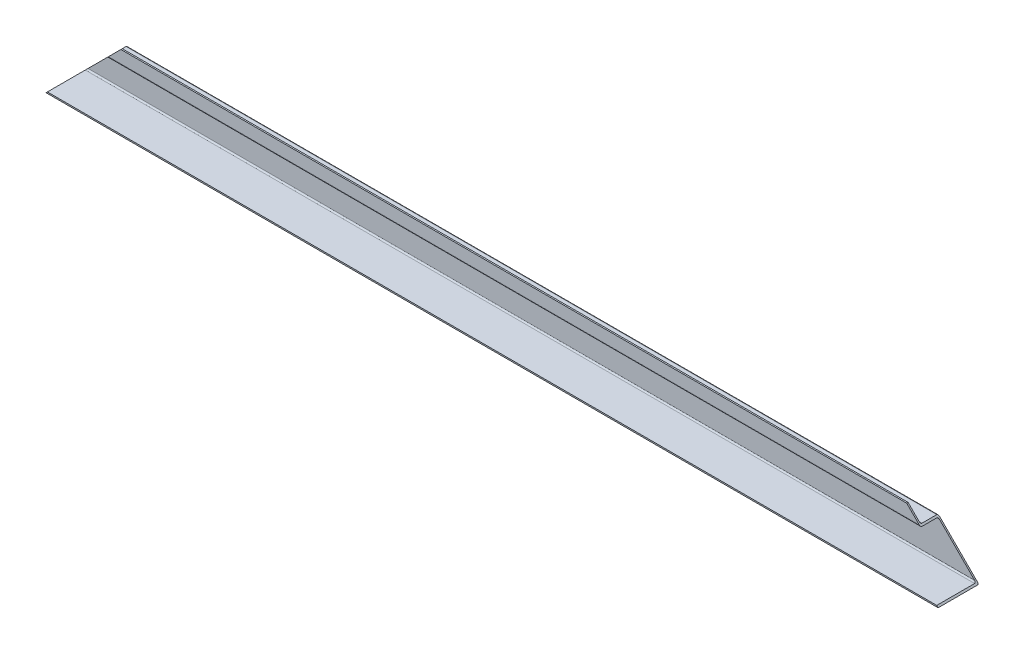
from build123d import *

# Parameters (mm, degrees)
BOSS_EXTRUDE1_DEPTH = 1930
FILLET1_R           = 3
CUT_EXTRUDE1_DEPTH  = 88
CUT_EXTRUDE2_DEPTH  = 88


with BuildPart() as part:
    # Sketch1 → Boss-Extrude1 (new body)
    with BuildSketch(Plane(origin=(0, 0, 0), x_dir=(0, 0, -1), z_dir=(1, 0, 0))):
        Polygon((0, 0), (85, 0), (85, 82), (47, 82), (47, 112), (50, 112), (50, 85), (88, 85), (88, -3), (0, -3), align=None)
    extrude(amount=BOSS_EXTRUDE1_DEPTH)

    # Fillet1
    fillet1_edges = [part.edges().sort_by_distance(p)[0] for p in [
        (965, 0, -85),
        (965, 82, -85),
        (965, 82, -47),
        (965, 85, -50),
        (965, 85, -88),
        (965, -3, -88),
    ]]
    fillet(fillet1_edges, radius=FILLET1_R)

    # Sketch4 → Cut-Extrude1 (cut)
    with BuildSketch(Plane(origin=(0, 0, -88), x_dir=(-1, 0, 0), z_dir=(0, 0, -1))):
        Polygon((-1930, -3), (-1815, 112), (-1930, 112), align=None)
    extrude(amount=-CUT_EXTRUDE1_DEPTH, mode=Mode.SUBTRACT)

    # Sketch5 → Cut-Extrude2 (cut)
    with BuildSketch(Plane(origin=(0, 0, -88), x_dir=(-1, 0, 0), z_dir=(0, 0, -1))):
        Polygon((0, -3), (-115, 112), (0, 112), align=None)
    extrude(amount=-CUT_EXTRUDE2_DEPTH, mode=Mode.SUBTRACT)


solid = part.part
